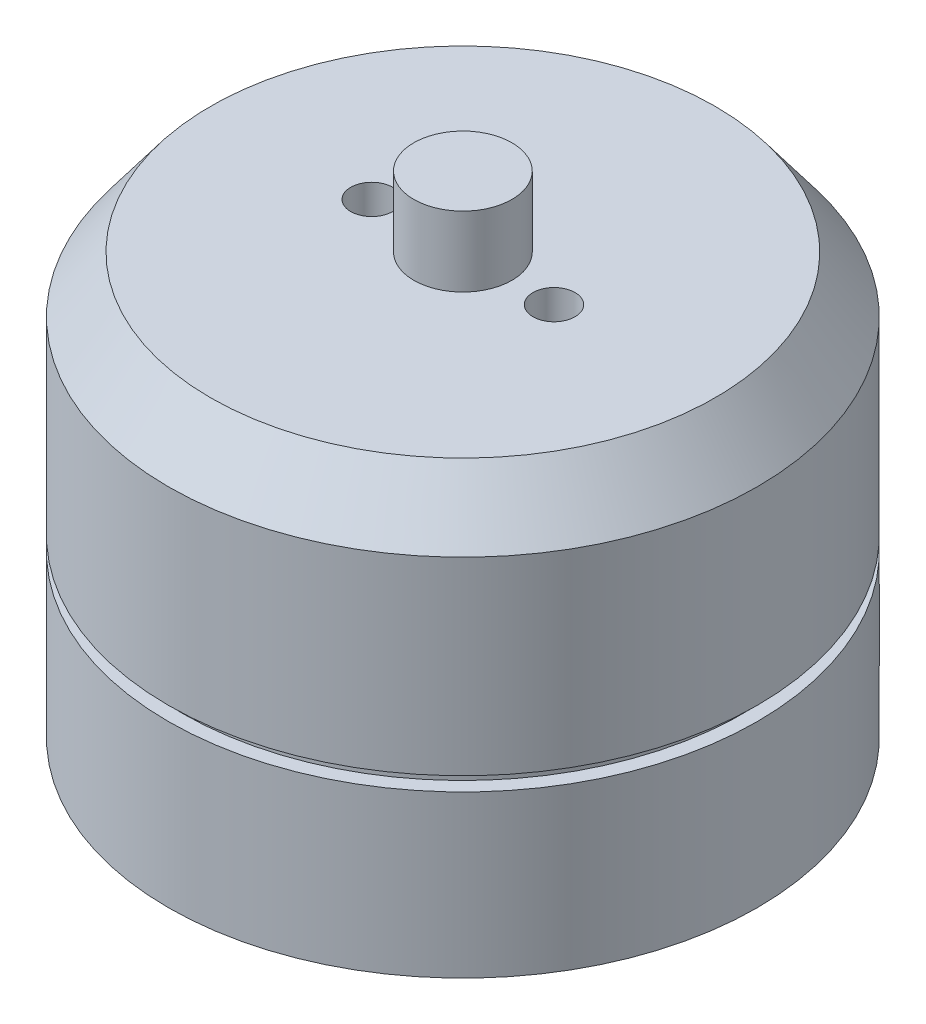
from build123d import *

# Parameters (mm, degrees)
SKETCH_1_R          = 21
EXTRUDE_1_DEPTH     = 30
CHAMFER_1_SIZE      = 4
CHAMFER_1_SIZE2     = 3
SKETCH_2_R          = 3.5
EXTRUDE_2_DEPTH     = 5
SKETCH_3_R          = 1.5
CUT_EXTRUDE_1_DEPTH = 4
SKETCH_4_R          = 13.365
EXTRUDE_3_DEPTH     = 2
SKETCH_5_R          = 1.5
CUT_EXTRUDE_2_DEPTH = 4
SKETCH_6_R          = 7.5
CUT_EXTRUDE_3_DEPTH = 5
SKETCH_7_R          = 2.5
EXTRUDE_4_DEPTH     = 12
SKETCH_8_W          = 1
SKETCH_8_H          = 1
EXTRUDE_5_DEPTH     = 7
SKETCH_10_W         = 30
SKETCH_10_H         = 4.75
CUT_EXTRUDE_4_DEPTH = 14


with BuildPart() as part:
    # 草图1 → 凸台-拉伸1 (new body)
    with BuildSketch(Plane(origin=(0, 0, 0), x_dir=(1, 0, 0), z_dir=(0, 1, 0))):
        with Locations(Location((0, 0, 0), (0, 0, 270))):
            Circle(SKETCH_1_R)
    extrude(amount=EXTRUDE_1_DEPTH)

    # 倒角1
    chamfer_1_edges = [part.edges().sort_by_distance(p)[0] for p in [
        (0, 30, -21),
    ]]
    chamfer_1_side = [part.faces().sort_by_distance(p)[0] for p in [
        (0, 15, -21),
    ]]
    chamfer(chamfer_1_edges, length=CHAMFER_1_SIZE, length2=CHAMFER_1_SIZE2, reference=chamfer_1_side[0])

    # 草图2 → 凸台-拉伸2 (add)
    with BuildSketch(Plane(origin=(0, 30, 0), x_dir=(1, 0, 0), z_dir=(0, 1, 0))):
        with Locations(Location((0, 0, 0), (0, 0, 270))):
            Circle(SKETCH_2_R)
    extrude(amount=EXTRUDE_2_DEPTH)

    # 草图3 → 切除-拉伸1 (cut)
    with BuildSketch(Plane(origin=(0, 30, 0), x_dir=(1, 0, 0), z_dir=(0, 1, 0))):
        with Locations(Location((6.5, 0, 0), (0, 0, 270))):
            Circle(SKETCH_3_R)
        with Locations(Location((-6.5, 0, 0), (0, 0, 270))):
            Circle(SKETCH_3_R)
    extrude(amount=-CUT_EXTRUDE_1_DEPTH, mode=Mode.SUBTRACT)

    # 草图4 → 凸台-拉伸3 (add)
    with BuildSketch(Plane(origin=(0, 0, 0), x_dir=(-1, 0, 0), z_dir=(0, -1, 0))):
        with Locations(Location((0, 0, 0), (0, 0, 270))):
            Circle(SKETCH_4_R)
    extrude(amount=EXTRUDE_3_DEPTH)

    # 草图5 → 切除-拉伸2 (cut)
    with BuildSketch(Plane(origin=(0, 0, 0), x_dir=(-1, 0, 0), z_dir=(0, -1, 0))):
        with Locations(Location((0, 17.5, 0), (0, 0, 90))):
            Circle(SKETCH_5_R)
        with Locations(Location((17.5, 0, 0), (0, 0, 90))):
            Circle(SKETCH_5_R)
        with Locations(Location((0, -17.5, 0), (0, 0, 90))):
            Circle(SKETCH_5_R)
        with Locations(Location((-17.5, 0, 0), (0, 0, 90))):
            Circle(SKETCH_5_R)
    extrude(amount=-CUT_EXTRUDE_2_DEPTH, mode=Mode.SUBTRACT)

    # 草图6 → 切除-拉伸3 (cut)
    with BuildSketch(Plane(origin=(0, -2, 0), x_dir=(-1, 0, 0), z_dir=(0, -1, 0))):
        with Locations(Location((0, 0, 0), (0, 0, 90))):
            Circle(SKETCH_6_R)
    extrude(amount=-CUT_EXTRUDE_3_DEPTH, mode=Mode.SUBTRACT)

    # 草图7 → 凸台-拉伸4 (add)
    with BuildSketch(Plane.XZ.offset(-3)):
        with Locations(Location((0, 0, 0), (0, 0, 270))):
            Circle(SKETCH_7_R)
    extrude(amount=EXTRUDE_4_DEPTH)

    # 草图8 → 切除-旋转1 (revolve, cut)
    with BuildSketch(Plane.XY, mode=Mode.PRIVATE) as cut_revolve_1_sk:
        with Locations((20.5, 12)):
            Rectangle(SKETCH_8_W, SKETCH_8_H)
    revolve(cut_revolve_1_sk.sketch.rotate(Axis((0, 26, 0), (0, -1, 0)), 90), axis=Axis((0, 26, 0), (0, -1, 0)), mode=Mode.SUBTRACT)

    # 草图9 → 凸台-拉伸5 (add)
    with BuildSketch(Plane.XZ.offset(9)):
        with BuildLine():
            ThreePointArc((3.27151241, -4.667676679), (3.435017376, -4.548698127), (3.594199256, -4.423994884))
            add(Edge.make_bspline(
                [(3.594199256, -4.423994884), (3.588341673, -4.371055443), (3.57704392, -4.288510414), (3.557045842, -4.17871332), (3.539100697, -4.095704087), (3.519699831, -4.018319233), (3.499191117, -3.946559726), (3.477920831, -3.880409738), (3.45623283, -3.819836866), (3.434467864, -3.76479225), (3.412962855, -3.71521076), (3.392050226, -3.671011182), (3.372057121, -3.632096507), (3.353305016, -3.598354002), (3.336108146, -3.569656099), (3.320775554, -3.545858911), (3.307602583, -3.526807808), (3.296891803, -3.512323476), (3.271755519, -3.480616202), (3.239242012, -3.449111408), (3.208005361, -3.408624212), (3.18990316, -3.383474283), (3.173472114, -3.358149214), (3.158636222, -3.332641108), (3.14542754, -3.306831197), (3.13388011, -3.280586394), (3.124075096, -3.253727871), (3.116155498, -3.226036506), (3.110360385, -3.197258888), (3.107065727, -3.167134913), (3.106830778, -3.135461921), (3.110417787, -3.102209244), (3.118774687, -3.067710564), (3.132765682, -3.032794727), (3.15151345, -3.001930189), (3.178982829, -2.967515274), (3.215428082, -2.931250004), (3.248175907, -2.891614083), (3.279909459, -2.861086475), (3.30891251, -2.839570861), (3.342388475, -2.822417923), (3.375968913, -2.810913535), (3.408748772, -2.804273658), (3.440308331, -2.801585189), (3.470607796, -2.802086304), (3.499797359, -2.805201432), (3.528101325, -2.810532209), (3.555749968, -2.817817205), (3.582948277, -2.826893811), (3.609866831, -2.837664709), (3.636635008, -2.850083723), (3.663368109, -2.864107974), (3.690081014, -2.879812412), (3.733277653, -2.907180126), (3.767648021, -2.93664804), (3.801539322, -2.958751519), (3.816950132, -2.968080162), (3.837135415, -2.979439126), (3.862245801, -2.992510584), (3.892408011, -3.006986188), (3.927736802, -3.022544934), (3.968330205, -3.038862158), (4.01427081, -3.055607355), (4.065625025, -3.072445825), (4.122443048, -3.089039069), (4.184758644, -3.105045593), (4.252589022, -3.120121593), (4.325934721, -3.133921689), (4.40477955, -3.14609962), (4.48909045, -3.156309089), (4.600264359, -3.16609106), (4.68349969, -3.169724325), (4.736753771, -3.170672285)],
                knots=[0.010676911, 0.010676911, 0.010676911, 0.010676911, 0.058364616, 0.085243058, 0.110585589, 0.134392209, 0.156662918, 0.177397716, 0.196596603, 0.21425958, 0.230386645, 0.2449778, 0.258033043, 0.269552376, 0.279535798, 0.287983309, 0.29489491, 0.3002706, 0.304110379, 0.331113618, 0.34062545, 0.349862158, 0.358855237, 0.367643072, 0.376272627, 0.384801461, 0.393300011, 0.401853859, 0.410565316, 0.419552882, 0.42894596, 0.438870848, 0.449423906, 0.460632045, 0.472412501, 0.481614351, 0.5, 0.518385649, 0.527587499, 0.539367955, 0.550576094, 0.561129152, 0.57105404, 0.580447118, 0.589434684, 0.598146141, 0.606699989, 0.615198539, 0.623727373, 0.632356928, 0.641144763, 0.650137842, 0.65937455, 0.668886382, 0.695889621, 0.6997294, 0.70510509, 0.712016691, 0.720464202, 0.730447624, 0.741966957, 0.7550222, 0.769613355, 0.78574042, 0.803403397, 0.822602284, 0.843337082, 0.865607791, 0.889414411, 0.914756942, 0.941635384, 0.989323089, 0.989323089, 0.989323089, 0.989323089], degree=3))
            ThreePointArc((4.736753771, -3.170672285), (4.846237601, -3.000663283), (4.949622276, -2.826877845))
            add(Edge.make_bspline(
                [(4.949622276, -2.826877845), (4.925036311, -2.779629288), (4.884682766, -2.706739561), (4.826371829, -2.611580959), (4.779652085, -2.540659688), (4.733606683, -2.475508863), (4.688560353, -2.416003717), (4.64483027, -2.362004404), (4.602725366, -2.313356492), (4.562545731, -2.269891329), (4.524582007, -2.231426472), (4.489114832, -2.197766106), (4.456414215, -2.168701595), (4.4267392, -2.144011687), (4.400336717, -2.123463916), (4.377442965, -2.10681247), (4.358277483, -2.093806472), (4.343057634, -2.084169414), (4.308164759, -2.063683534), (4.266465973, -2.046051422), (4.222713001, -2.019582216), (4.196747998, -2.002669875), (4.172278035, -1.98499053), (4.149229386, -1.966564272), (4.127589042, -1.947268774), (4.107340668, -1.926967636), (4.088495347, -1.905464789), (4.071107267, -1.882504249), (4.055307811, -1.857763355), (4.041353598, -1.830863753), (4.029692911, -1.80141444), (4.021025444, -1.769111466), (4.016355661, -1.733923544), (4.01678882, -1.696311366), (4.023121036, -1.660758566), (4.036303368, -1.618744529), (4.057187027, -1.571762628), (4.073405319, -1.522973354), (4.091968131, -1.483043726), (4.111240334, -1.452503903), (4.136259386, -1.424416351), (4.163416348, -1.401558176), (4.191584055, -1.383525224), (4.220041281, -1.369617674), (4.248475714, -1.35913952), (4.276819485, -1.351499804), (4.305137846, -1.346246034), (4.333551082, -1.343051249), (4.362191599, -1.341689769), (4.391183299, -1.342009228), (4.420630146, -1.343919833), (4.450624165, -1.347339948), (4.481206304, -1.352334086), (4.531372329, -1.362249293), (4.574066781, -1.377311296), (4.613654175, -1.385679226), (4.631394222, -1.388810901), (4.654319769, -1.392111054), (4.682456462, -1.395228908), (4.715811076, -1.397831159), (4.75437466, -1.399577026), (4.798121343, -1.400128356), (4.847008743, -1.399147126), (4.90097788, -1.39629725), (4.95995328, -1.391244952), (5.023843065, -1.383659602), (5.092539089, -1.373214394), (5.165917086, -1.359587077), (5.243836876, -1.342460623), (5.326142534, -1.321524058), (5.433342772, -1.290484828), (5.512269894, -1.263804677), (5.562270288, -1.24545103)],
                knots=[0.010676911, 0.010676911, 0.010676911, 0.010676911, 0.058364616, 0.085243058, 0.110585589, 0.134392209, 0.156662918, 0.177397716, 0.196596603, 0.21425958, 0.230386645, 0.2449778, 0.258033043, 0.269552376, 0.279535798, 0.287983309, 0.29489491, 0.3002706, 0.304110379, 0.331113618, 0.34062545, 0.349862158, 0.358855237, 0.367643072, 0.376272627, 0.384801461, 0.393300011, 0.401853859, 0.410565316, 0.419552882, 0.42894596, 0.438870848, 0.449423906, 0.460632045, 0.472412501, 0.481614351, 0.5, 0.518385649, 0.527587499, 0.539367955, 0.550576094, 0.561129152, 0.57105404, 0.580447118, 0.589434684, 0.598146141, 0.606699989, 0.615198539, 0.623727373, 0.632356928, 0.641144763, 0.650137842, 0.65937455, 0.668886382, 0.695889621, 0.6997294, 0.70510509, 0.712016691, 0.720464202, 0.730447624, 0.741966957, 0.7550222, 0.769613355, 0.78574042, 0.803403397, 0.822602284, 0.843337082, 0.865607791, 0.889414411, 0.914756942, 0.941635384, 0.989323089, 0.989323089, 0.989323089, 0.989323089], degree=3))
            ThreePointArc((5.562270288, -1.24545103), (5.602946584, -1.047372236), (5.636571381, -0.847975288))
            add(Edge.make_bspline(
                [(5.636571381, -0.847975288), (5.596577504, -0.812798797), (5.532618137, -0.759408532), (5.443869556, -0.691740119), (5.374684975, -0.64248512), (5.308213723, -0.598367303), (5.244713533, -0.559153018), (5.184429643, -0.524597286), (5.127594337, -0.494444505), (5.074426515, -0.468429006), (5.025131288, -0.446275674), (4.979899606, -0.427700539), (4.938907876, -0.412411514), (4.902317725, -0.400108714), (4.870275432, -0.390486164), (4.842912448, -0.383229331), (4.82034286, -0.378024969), (4.802669467, -0.374536724), (4.762732476, -0.36803897), (4.717480062, -0.366660855), (4.667119851, -0.357784451), (4.636798765, -0.351393804), (4.607594687, -0.343747876), (4.57944613, -0.334892034), (4.552296772, -0.324716912), (4.526082109, -0.313101221), (4.500741646, -0.299858128), (4.476233441, -0.284729362), (4.452563445, -0.267366587), (4.429834272, -0.247324298), (4.408322686, -0.224075958), (4.388571334, -0.197085382), (4.371505548, -0.165960542), (4.35832237, -0.130731755), (4.351383833, -0.095292296), (4.348498771, -0.051353366), (4.351000383, 0), (4.348498771, 0.051353366), (4.351383833, 0.095292296), (4.35832237, 0.130731755), (4.371505548, 0.165960542), (4.388571334, 0.197085382), (4.408322686, 0.224075958), (4.429834272, 0.247324298), (4.452563445, 0.267366587), (4.476233441, 0.284729362), (4.500741646, 0.299858128), (4.526082109, 0.313101221), (4.552296772, 0.324716912), (4.57944613, 0.334892034), (4.607594687, 0.343747876), (4.636798765, 0.351393804), (4.667119851, 0.357784451), (4.717480062, 0.366660855), (4.762732476, 0.36803897), (4.802669467, 0.374536724), (4.82034286, 0.378024969), (4.842912448, 0.383229331), (4.870275432, 0.390486164), (4.902317725, 0.400108714), (4.938907876, 0.412411514), (4.979899606, 0.427700539), (5.025131288, 0.446275674), (5.074426515, 0.468429006), (5.127594337, 0.494444505), (5.184429643, 0.524597286), (5.244713533, 0.559153018), (5.308213723, 0.598367303), (5.374684975, 0.64248512), (5.443869556, 0.691740119), (5.532618137, 0.759408532), (5.596577504, 0.812798797), (5.636571381, 0.847975288)],
                knots=[0.010676911, 0.010676911, 0.010676911, 0.010676911, 0.058364616, 0.085243058, 0.110585589, 0.134392209, 0.156662918, 0.177397716, 0.196596603, 0.21425958, 0.230386645, 0.2449778, 0.258033043, 0.269552376, 0.279535798, 0.287983309, 0.29489491, 0.3002706, 0.304110379, 0.331113618, 0.34062545, 0.349862158, 0.358855237, 0.367643072, 0.376272627, 0.384801461, 0.393300011, 0.401853859, 0.410565316, 0.419552882, 0.42894596, 0.438870848, 0.449423906, 0.460632045, 0.472412501, 0.481614351, 0.5, 0.518385649, 0.527587499, 0.539367955, 0.550576094, 0.561129152, 0.57105404, 0.580447118, 0.589434684, 0.598146141, 0.606699989, 0.615198539, 0.623727373, 0.632356928, 0.641144763, 0.650137842, 0.65937455, 0.668886382, 0.695889621, 0.6997294, 0.70510509, 0.712016691, 0.720464202, 0.730447624, 0.741966957, 0.7550222, 0.769613355, 0.78574042, 0.803403397, 0.822602284, 0.843337082, 0.865607791, 0.889414411, 0.914756942, 0.941635384, 0.989323089, 0.989323089, 0.989323089, 0.989323089], degree=3))
            ThreePointArc((5.636571381, 0.847975288), (5.602946584, 1.047372236), (5.562270288, 1.24545103))
            add(Edge.make_bspline(
                [(5.562270288, 1.24545103), (5.512269894, 1.263804677), (5.433342772, 1.290484828), (5.326142534, 1.321524058), (5.243836876, 1.342460623), (5.165917086, 1.359587077), (5.092539089, 1.373214394), (5.023843065, 1.383659602), (4.95995328, 1.391244952), (4.90097788, 1.39629725), (4.847008743, 1.399147126), (4.798121343, 1.400128356), (4.75437466, 1.399577026), (4.715811076, 1.397831159), (4.682456462, 1.395228908), (4.654319769, 1.392111054), (4.631394222, 1.388810901), (4.613654175, 1.385679226), (4.574066781, 1.377311296), (4.531372329, 1.362249293), (4.481206304, 1.352334086), (4.450624165, 1.347339948), (4.420630146, 1.343919833), (4.391183299, 1.342009228), (4.362191599, 1.341689769), (4.333551082, 1.343051249), (4.305137846, 1.346246034), (4.276819485, 1.351499804), (4.248475714, 1.35913952), (4.220041281, 1.369617674), (4.191584055, 1.383525224), (4.163416348, 1.401558176), (4.136259386, 1.424416351), (4.111240334, 1.452503903), (4.091968131, 1.483043726), (4.073405319, 1.522973354), (4.057187027, 1.571762628), (4.036303368, 1.618744529), (4.023121036, 1.660758566), (4.01678882, 1.696311366), (4.016355661, 1.733923544), (4.021025444, 1.769111466), (4.029692911, 1.80141444), (4.041353598, 1.830863753), (4.055307811, 1.857763355), (4.071107267, 1.882504249), (4.088495347, 1.905464789), (4.107340668, 1.926967636), (4.127589042, 1.947268774), (4.149229386, 1.966564272), (4.172278035, 1.98499053), (4.196747998, 2.002669875), (4.222713001, 2.019582216), (4.266465973, 2.046051422), (4.308164759, 2.063683534), (4.343057634, 2.084169414), (4.358277483, 2.093806472), (4.377442965, 2.10681247), (4.400336717, 2.123463916), (4.4267392, 2.144011687), (4.456414215, 2.168701595), (4.489114832, 2.197766106), (4.524582007, 2.231426472), (4.562545731, 2.269891329), (4.602725366, 2.313356492), (4.64483027, 2.362004404), (4.688560353, 2.416003717), (4.733606683, 2.475508863), (4.779652085, 2.540659688), (4.826371829, 2.611580959), (4.884682766, 2.706739561), (4.925036311, 2.779629288), (4.949622276, 2.826877845)],
                knots=[0.010676911, 0.010676911, 0.010676911, 0.010676911, 0.058364616, 0.085243058, 0.110585589, 0.134392209, 0.156662918, 0.177397716, 0.196596603, 0.21425958, 0.230386645, 0.2449778, 0.258033043, 0.269552376, 0.279535798, 0.287983309, 0.29489491, 0.3002706, 0.304110379, 0.331113618, 0.34062545, 0.349862158, 0.358855237, 0.367643072, 0.376272627, 0.384801461, 0.393300011, 0.401853859, 0.410565316, 0.419552882, 0.42894596, 0.438870848, 0.449423906, 0.460632045, 0.472412501, 0.481614351, 0.5, 0.518385649, 0.527587499, 0.539367955, 0.550576094, 0.561129152, 0.57105404, 0.580447118, 0.589434684, 0.598146141, 0.606699989, 0.615198539, 0.623727373, 0.632356928, 0.641144763, 0.650137842, 0.65937455, 0.668886382, 0.695889621, 0.6997294, 0.70510509, 0.712016691, 0.720464202, 0.730447624, 0.741966957, 0.7550222, 0.769613355, 0.78574042, 0.803403397, 0.822602284, 0.843337082, 0.865607791, 0.889414411, 0.914756942, 0.941635384, 0.989323089, 0.989323089, 0.989323089, 0.989323089], degree=3))
            ThreePointArc((4.949622276, 2.826877845), (4.846237601, 3.000663283), (4.736753771, 3.170672285))
            add(Edge.make_bspline(
                [(4.736753771, 3.170672285), (4.68349969, 3.169724325), (4.600264359, 3.16609106), (4.48909045, 3.156309089), (4.40477955, 3.14609962), (4.325934721, 3.133921689), (4.252589022, 3.120121593), (4.184758644, 3.105045593), (4.122443048, 3.089039069), (4.065625025, 3.072445825), (4.01427081, 3.055607355), (3.968330205, 3.038862158), (3.927736802, 3.022544934), (3.892408011, 3.006986188), (3.862245801, 2.992510584), (3.837135415, 2.979439126), (3.816950132, 2.968080162), (3.801539322, 2.958751519), (3.767648021, 2.93664804), (3.733277653, 2.907180126), (3.690081014, 2.879812412), (3.663368109, 2.864107974), (3.636635008, 2.850083723), (3.609866831, 2.837664709), (3.582948277, 2.826893811), (3.555749968, 2.817817205), (3.528101325, 2.810532209), (3.499797359, 2.805201432), (3.470607796, 2.802086304), (3.440308331, 2.801585189), (3.408748772, 2.804273658), (3.375968913, 2.810913535), (3.342388475, 2.822417923), (3.30891251, 2.839570861), (3.279909459, 2.861086475), (3.248175907, 2.891614083), (3.215428082, 2.931250004), (3.178982829, 2.967515274), (3.15151345, 3.001930189), (3.132765682, 3.032794727), (3.118774687, 3.067710564), (3.110417787, 3.102209244), (3.106830778, 3.135461921), (3.107065727, 3.167134913), (3.110360385, 3.197258888), (3.116155498, 3.226036506), (3.124075096, 3.253727871), (3.13388011, 3.280586394), (3.14542754, 3.306831197), (3.158636222, 3.332641108), (3.173472114, 3.358149214), (3.18990316, 3.383474283), (3.208005361, 3.408624212), (3.239242012, 3.449111408), (3.271755519, 3.480616202), (3.296891803, 3.512323476), (3.307602583, 3.526807808), (3.320775554, 3.545858911), (3.336108146, 3.569656099), (3.353305016, 3.598354002), (3.372057121, 3.632096507), (3.392050226, 3.671011182), (3.412962855, 3.71521076), (3.434467864, 3.76479225), (3.45623283, 3.819836866), (3.477920831, 3.880409738), (3.499191117, 3.946559726), (3.519699831, 4.018319233), (3.539100697, 4.095704087), (3.557045842, 4.17871332), (3.57704392, 4.288510414), (3.588341673, 4.371055443), (3.594199256, 4.423994884)],
                knots=[0.010676911, 0.010676911, 0.010676911, 0.010676911, 0.058364616, 0.085243058, 0.110585589, 0.134392209, 0.156662918, 0.177397716, 0.196596603, 0.21425958, 0.230386645, 0.2449778, 0.258033043, 0.269552376, 0.279535798, 0.287983309, 0.29489491, 0.3002706, 0.304110379, 0.331113618, 0.34062545, 0.349862158, 0.358855237, 0.367643072, 0.376272627, 0.384801461, 0.393300011, 0.401853859, 0.410565316, 0.419552882, 0.42894596, 0.438870848, 0.449423906, 0.460632045, 0.472412501, 0.481614351, 0.5, 0.518385649, 0.527587499, 0.539367955, 0.550576094, 0.561129152, 0.57105404, 0.580447118, 0.589434684, 0.598146141, 0.606699989, 0.615198539, 0.623727373, 0.632356928, 0.641144763, 0.650137842, 0.65937455, 0.668886382, 0.695889621, 0.6997294, 0.70510509, 0.712016691, 0.720464202, 0.730447624, 0.741966957, 0.7550222, 0.769613355, 0.78574042, 0.803403397, 0.822602284, 0.843337082, 0.865607791, 0.889414411, 0.914756942, 0.941635384, 0.989323089, 0.989323089, 0.989323089, 0.989323089], degree=3))
            ThreePointArc((3.594199256, 4.423994884), (3.435017376, 4.548698127), (3.27151241, 4.667676679))
            add(Edge.make_bspline(
                [(3.27151241, 4.667676679), (3.222196901, 4.64755514), (3.145894752, 4.614099151), (3.045761826, 4.564817086), (2.970832338, 4.524840431), (2.901710901, 4.48500281), (2.838303243, 4.445639081), (2.780499378, 4.407077972), (2.72817404, 4.369641343), (2.681186982, 4.333643566), (2.639383359, 4.299390878), (2.602594084, 4.267180787), (2.570636325, 4.237301399), (2.543313675, 4.21003107), (2.520417443, 4.185637125), (2.501724661, 4.164377435), (2.487005776, 4.146493752), (2.476005518, 4.132228024), (2.452387519, 4.099374194), (2.430983144, 4.059480173), (2.400589836, 4.018356114), (2.381353891, 3.994062347), (2.36149216, 3.971328012), (2.341017844, 3.950077846), (2.319807938, 3.93031018), (2.297725117, 3.912021334), (2.27457517, 3.895240436), (2.250108207, 3.880045062), (2.224015063, 3.866595806), (2.195942678, 3.855183101), (2.165543078, 3.846289396), (2.13257817, 3.840639446), (2.09710948, 3.839236315), (2.059697716, 3.84313804), (2.02488084, 3.852723642), (1.98426234, 3.869726307), (1.939407757, 3.894855824), (1.892323044, 3.915506637), (1.854276509, 3.937674505), (1.825645179, 3.959682355), (1.79998591, 3.987186273), (1.779730972, 4.016336474), (1.764373934, 4.046047894), (1.753151412, 4.075666953), (1.745341555, 4.104946892), (1.740349661, 4.133874657), (1.737731192, 4.162556974), (1.737171678, 4.191143781), (1.738458619, 4.219787744), (1.741451733, 4.248626295), (1.7460712, 4.277771239), (1.752244224, 4.30732174), (1.760038821, 4.33731262), (1.774540469, 4.386349786), (1.793477567, 4.427472364), (1.805462465, 4.466118791), (1.810217625, 4.483494208), (1.815619003, 4.506017458), (1.821319683, 4.533746446), (1.826988409, 4.56671867), (1.832285027, 4.60495666), (1.83687044, 4.648465856), (1.840404156, 4.697235249), (1.842546081, 4.751237116), (1.842956898, 4.810427104), (1.841298912, 4.874744235), (1.837236731, 4.944110975), (1.830438013, 5.018433325), (1.820574148, 5.097600953), (1.807321104, 5.181487293), (1.786305471, 5.291094172), (1.767021609, 5.372146338), (1.75335971, 5.4236269)],
                knots=[0.010676911, 0.010676911, 0.010676911, 0.010676911, 0.058364616, 0.085243058, 0.110585589, 0.134392209, 0.156662918, 0.177397716, 0.196596603, 0.21425958, 0.230386645, 0.2449778, 0.258033043, 0.269552376, 0.279535798, 0.287983309, 0.29489491, 0.3002706, 0.304110379, 0.331113618, 0.34062545, 0.349862158, 0.358855237, 0.367643072, 0.376272627, 0.384801461, 0.393300011, 0.401853859, 0.410565316, 0.419552882, 0.42894596, 0.438870848, 0.449423906, 0.460632045, 0.472412501, 0.481614351, 0.5, 0.518385649, 0.527587499, 0.539367955, 0.550576094, 0.561129152, 0.57105404, 0.580447118, 0.589434684, 0.598146141, 0.606699989, 0.615198539, 0.623727373, 0.632356928, 0.641144763, 0.650137842, 0.65937455, 0.668886382, 0.695889621, 0.6997294, 0.70510509, 0.712016691, 0.720464202, 0.730447624, 0.741966957, 0.7550222, 0.769613355, 0.78574042, 0.803403397, 0.822602284, 0.843337082, 0.865607791, 0.889414411, 0.914756942, 0.941635384, 0.989323089, 0.989323089, 0.989323089, 0.989323089], degree=3))
            ThreePointArc((1.75335971, 5.4236269), (1.55987902, 5.482406084), (1.36443517, 5.534285473))
            add(Edge.make_bspline(
                [(1.36443517, 5.534285473), (1.325718565, 5.49770788), (1.266654628, 5.438947584), (1.19108619, 5.356821242), (1.135657757, 5.292476468), (1.085594945, 5.23035945), (1.040688884, 5.170748378), (1.000718265, 5.11391005), (0.96545001, 5.06009934), (0.93463978, 5.009558731), (0.908032561, 4.96251784), (0.885363211, 4.919193005), (0.866357167, 4.879786832), (0.850730734, 4.844487927), (0.838192743, 4.813470178), (0.828442129, 4.786893496), (0.821177509, 4.764900383), (0.816073449, 4.747624236), (0.805918493, 4.708457147), (0.80037089, 4.663524928), (0.786885698, 4.614198556), (0.777724635, 4.584596469), (0.767416711, 4.556222448), (0.756001426, 4.529011082), (0.743364681, 4.50291638), (0.729379758, 4.477885305), (0.713855034, 4.453874858), (0.696529473, 4.430867107), (0.677056773, 4.408900118), (0.655002797, 4.388117173), (0.629868792, 4.368842438), (0.601170928, 4.351665718), (0.568604229, 4.337544569), (0.532309332, 4.327668131), (0.496380844, 4.324029133), (0.452363149, 4.325210551), (0.401459667, 4.332439782), (0.350094546, 4.334687133), (0.306609252, 4.34161406), (0.271961178, 4.35179294), (0.238099062, 4.368170382), (0.208681627, 4.388035207), (0.183628613, 4.41019268), (0.162464285, 4.433757587), (0.144604676, 4.458239071), (0.12949996, 4.483410129), (0.116697062, 4.509209693), (0.105848584, 4.535663977), (0.096701229, 4.562838574), (0.089074538, 4.590810959), (0.082853694, 4.619656553), (0.077934996, 4.649441529), (0.074369286, 4.680222925), (0.070177402, 4.731187319), (0.072980531, 4.776373851), (0.070195416, 4.816740014), (0.068352747, 4.834659871), (0.065253045, 4.857613379), (0.060551905, 4.885529213), (0.053926894, 4.918322676), (0.045052688, 4.955891899), (0.033611123, 4.998119459), (0.019288679, 5.044872088), (0.001778239, 5.096001082), (-0.019220575, 5.151342507), (-0.044000629, 5.210717511), (-0.072846657, 5.273932641), (-0.106034601, 5.340780189), (-0.143831027, 5.411038564), (-0.186492364, 5.484472694), (-0.24568343, 5.579086343), (-0.292944515, 5.647699103), (-0.324280781, 5.69076805)],
                knots=[0.010676911, 0.010676911, 0.010676911, 0.010676911, 0.058364616, 0.085243058, 0.110585589, 0.134392209, 0.156662918, 0.177397716, 0.196596603, 0.21425958, 0.230386645, 0.2449778, 0.258033043, 0.269552376, 0.279535798, 0.287983309, 0.29489491, 0.3002706, 0.304110379, 0.331113618, 0.34062545, 0.349862158, 0.358855237, 0.367643072, 0.376272627, 0.384801461, 0.393300011, 0.401853859, 0.410565316, 0.419552882, 0.42894596, 0.438870848, 0.449423906, 0.460632045, 0.472412501, 0.481614351, 0.5, 0.518385649, 0.527587499, 0.539367955, 0.550576094, 0.561129152, 0.57105404, 0.580447118, 0.589434684, 0.598146141, 0.606699989, 0.615198539, 0.623727373, 0.632356928, 0.641144763, 0.650137842, 0.65937455, 0.668886382, 0.695889621, 0.6997294, 0.70510509, 0.712016691, 0.720464202, 0.730447624, 0.741966957, 0.7550222, 0.769613355, 0.78574042, 0.803403397, 0.822602284, 0.843337082, 0.865607791, 0.889414411, 0.914756942, 0.941635384, 0.989323089, 0.989323089, 0.989323089, 0.989323089], degree=3))
            ThreePointArc((-0.324280781, 5.69076805), (-0.525929641, 5.67568472), (-0.726916601, 5.653458347))
            add(Edge.make_bspline(
                [(-0.726916601, 5.653458347), (-0.749805409, 5.605364707), (-0.783654223, 5.529236008), (-0.824452236, 5.425357006), (-0.852893697, 5.345334232), (-0.877136624, 5.269327064), (-0.897476276, 5.197519454), (-0.914215396, 5.130080238), (-0.927663394, 5.067162883), (-0.938135703, 5.008905229), (-0.945953066, 4.955429269), (-0.951440871, 4.906840949), (-0.954928327, 4.863230012), (-0.956748106, 4.824669846), (-0.957234531, 4.791217411), (-0.956726104, 4.762913065), (-0.955555331, 4.739780815), (-0.954073861, 4.721827488), (-0.949394291, 4.681636872), (-0.938335887, 4.637734801), (-0.933091713, 4.586867915), (-0.930940643, 4.555955433), (-0.930302617, 4.525773795), (-0.931117175, 4.496276275), (-0.933474094, 4.467378772), (-0.93747238, 4.438986052), (-0.943275179, 4.4109888), (-0.951119426, 4.383275997), (-0.961341786, 4.355758039), (-0.97439884, 4.328411705), (-0.990872765, 4.3013591), (-1.011427779, 4.274975421), (-1.036694174, 4.250043393), (-1.066970377, 4.22772266), (-1.099158136, 4.211350528), (-1.140630192, 4.196551143), (-1.190707775, 4.184903742), (-1.23941616, 4.168444112), (-1.282467285, 4.159194579), (-1.318452686, 4.156169774), (-1.355944384, 4.159208877), (-1.390551327, 4.167105471), (-1.42191677, 4.178716506), (-1.450164545, 4.193044691), (-1.475661866, 4.20942136), (-1.498839429, 4.22743622), (-1.520097654, 4.246868656), (-1.539769947, 4.267617619), (-1.558116199, 4.28965277), (-1.575332667, 4.312981164), (-1.591553661, 4.337631652), (-1.606899785, 4.363628475), (-1.621344233, 4.39104319), (-1.643663512, 4.437051789), (-1.657372929, 4.480199582), (-1.674551912, 4.516833809), (-1.682743549, 4.532877928), (-1.693925699, 4.553161696), (-1.708393743, 4.577494188), (-1.726417748, 4.605679952), (-1.748264267, 4.637506476), (-1.774187562, 4.672749333), (-1.804431841, 4.711170998), (-1.839229763, 4.752521864), (-1.878802203, 4.79654056), (-1.92335764, 4.842954514), (-1.973091699, 4.89148048), (-2.028186655, 4.941825093), (-2.088811025, 4.993685433), (-2.155119005, 5.046749668), (-2.244491422, 5.113591989), (-2.313346859, 5.160498809), (-2.358125355, 5.189339441)],
                knots=[0.010676911, 0.010676911, 0.010676911, 0.010676911, 0.058364616, 0.085243058, 0.110585589, 0.134392209, 0.156662918, 0.177397716, 0.196596603, 0.21425958, 0.230386645, 0.2449778, 0.258033043, 0.269552376, 0.279535798, 0.287983309, 0.29489491, 0.3002706, 0.304110379, 0.331113618, 0.34062545, 0.349862158, 0.358855237, 0.367643072, 0.376272627, 0.384801461, 0.393300011, 0.401853859, 0.410565316, 0.419552882, 0.42894596, 0.438870848, 0.449423906, 0.460632045, 0.472412501, 0.481614351, 0.5, 0.518385649, 0.527587499, 0.539367955, 0.550576094, 0.561129152, 0.57105404, 0.580447118, 0.589434684, 0.598146141, 0.606699989, 0.615198539, 0.623727373, 0.632356928, 0.641144763, 0.650137842, 0.65937455, 0.668886382, 0.695889621, 0.6997294, 0.70510509, 0.712016691, 0.720464202, 0.730447624, 0.741966957, 0.7550222, 0.769613355, 0.78574042, 0.803403397, 0.822602284, 0.843337082, 0.865607791, 0.889414411, 0.914756942, 0.941635384, 0.989323089, 0.989323089, 0.989323089, 0.989323089], degree=3))
            ThreePointArc((-2.358125355, 5.189339441), (-2.54070859, 5.102430684), (-2.720094256, 5.009100344))
            add(Edge.make_bspline(
                [(-2.720094256, 5.009100344), (-2.724064007, 4.955985969), (-2.728126229, 4.87277047), (-2.728643819, 4.761168244), (-2.726257131, 4.676274988), (-2.721406031, 4.596642859), (-2.714432292, 4.522336727), (-2.705679201, 4.453404664), (-2.695490716, 4.389878), (-2.684210761, 4.331771321), (-2.67218249, 4.279082516), (-2.65974759, 4.231792834), (-2.647245459, 4.189867032), (-2.635012813, 4.153253367), (-2.623381978, 4.121884184), (-2.612683174, 4.095674832), (-2.603235129, 4.074527583), (-2.59536821, 4.058321774), (-2.576486115, 4.022535596), (-2.550315203, 3.98559289), (-2.527049918, 3.940055346), (-2.513877229, 3.912007371), (-2.502379422, 3.884094313), (-2.492483241, 3.856294443), (-2.484242021, 3.828496906), (-2.477713678, 3.800577136), (-2.473010853, 3.772374263), (-2.470314376, 3.743699175), (-2.46990581, 3.714346701), (-2.472202515, 3.684130252), (-2.477791464, 3.65295338), (-2.48742756, 3.620926005), (-2.501981285, 3.588550307), (-2.522149824, 3.556799817), (-2.54624972, 3.529905699), (-2.579575105, 3.501124249), (-2.622063534, 3.472173262), (-2.661536846, 3.439229615), (-2.698339508, 3.415052823), (-2.73080221, 3.39923285), (-2.766860027, 3.388523165), (-2.80198262, 3.38338505), (-2.835424414, 3.382881513), (-2.866940617, 3.386037875), (-2.896632095, 3.392097969), (-2.924752248, 3.400523624), (-2.951594757, 3.410964475), (-2.977434015, 3.423205855), (-3.0025014, 3.43712559), (-3.026982466, 3.452659364), (-3.051012876, 3.46978556), (-3.074713846, 3.488483217), (-3.09808623, 3.50882874), (-3.13551856, 3.543667828), (-3.163888992, 3.578949534), (-3.193141726, 3.606904169), (-3.206576004, 3.618905704), (-3.22433039, 3.633780295), (-3.24661135, 3.651243209), (-3.273600106, 3.671014629), (-3.305468445, 3.692800106), (-3.342372386, 3.716298517), (-3.384453843, 3.741200159), (-3.431839594, 3.767188234), (-3.484641182, 3.793939231), (-3.542954545, 3.821123674), (-3.606859774, 3.848406776), (-3.676420863, 3.875449135), (-3.75168552, 3.901907414), (-3.832684882, 3.927435134), (-3.94016841, 3.957478701), (-4.021318891, 3.976344555), (-4.073492033, 3.987061785)],
                knots=[0.010676911, 0.010676911, 0.010676911, 0.010676911, 0.058364616, 0.085243058, 0.110585589, 0.134392209, 0.156662918, 0.177397716, 0.196596603, 0.21425958, 0.230386645, 0.2449778, 0.258033043, 0.269552376, 0.279535798, 0.287983309, 0.29489491, 0.3002706, 0.304110379, 0.331113618, 0.34062545, 0.349862158, 0.358855237, 0.367643072, 0.376272627, 0.384801461, 0.393300011, 0.401853859, 0.410565316, 0.419552882, 0.42894596, 0.438870848, 0.449423906, 0.460632045, 0.472412501, 0.481614351, 0.5, 0.518385649, 0.527587499, 0.539367955, 0.550576094, 0.561129152, 0.57105404, 0.580447118, 0.589434684, 0.598146141, 0.606699989, 0.615198539, 0.623727373, 0.632356928, 0.641144763, 0.650137842, 0.65937455, 0.668886382, 0.695889621, 0.6997294, 0.70510509, 0.712016691, 0.720464202, 0.730447624, 0.741966957, 0.7550222, 0.769613355, 0.78574042, 0.803403397, 0.822602284, 0.843337082, 0.865607791, 0.889414411, 0.914756942, 0.941635384, 0.989323089, 0.989323089, 0.989323089, 0.989323089], degree=3))
            ThreePointArc((-4.073492033, 3.987061785), (-4.212350765, 3.840065111), (-4.34590811, 3.688235584))
            add(Edge.make_bspline(
                [(-4.34590811, 3.688235584), (-4.330422667, 3.637273865), (-4.30414967, 3.558210279), (-4.264316934, 3.453957327), (-4.231424433, 3.375658895), (-4.198134474, 3.303156566), (-4.164789185, 3.236387367), (-4.131726038, 3.175272113), (-4.09927708, 3.119715768), (-4.067768283, 3.069607693), (-4.037518862, 3.024821958), (-4.008840659, 2.985217647), (-3.982037422, 2.950639292), (-3.957404439, 2.920917007), (-3.935227152, 2.895867657), (-3.915782905, 2.875293018), (-3.899333597, 2.858986824), (-3.8861437, 2.846717216), (-3.855609213, 2.820168598), (-3.817860319, 2.795174574), (-3.779716029, 2.761116469), (-3.757300765, 2.739721036), (-3.73649602, 2.717846372), (-3.717225634, 2.695498677), (-3.699499297, 2.672555318), (-3.683326014, 2.648879218), (-3.668752708, 2.624279678), (-3.655879681, 2.598515034), (-3.644895368, 2.571292259), (-3.636121541, 2.542286594), (-3.630070696, 2.511196066), (-3.627486466, 2.477850468), (-3.629361959, 2.442403617), (-3.636698961, 2.40551145), (-3.649456169, 2.371727546), (-3.670134106, 2.332851125), (-3.699295083, 2.290506542), (-3.724202233, 2.245528102), (-3.749786028, 2.209689259), (-3.774341763, 2.183210693), (-3.804095892, 2.160198624), (-3.834990633, 2.142719731), (-3.865992279, 2.130169627), (-3.896520472, 2.121727881), (-3.92639611, 2.116652951), (-3.955661069, 2.114351469), (-3.984462634, 2.11439064), (-4.01297912, 2.116471171), (-4.041382149, 2.120395554), (-4.06982151, 2.126036785), (-4.098415896, 2.133325702), (-4.127270765, 2.142198969), (-4.156414514, 2.152727526), (-4.203904453, 2.171691891), (-4.243104315, 2.19434252), (-4.280480055, 2.209842134), (-4.297342601, 2.216180211), (-4.319271396, 2.223636731), (-4.346356104, 2.231871601), (-4.37866463, 2.240558438), (-4.416250793, 2.249360619), (-4.459151299, 2.257940993), (-4.507386599, 2.265959507), (-4.560960472, 2.273074958), (-4.619860061, 2.278945386), (-4.684055806, 2.283228908), (-4.753501451, 2.285584411), (-4.828134061, 2.285672297), (-4.907874096, 2.283155177), (-4.992625428, 2.277698723), (-5.103703822, 2.266885986), (-5.186189524, 2.255162936), (-5.23871104, 2.246309343)],
                knots=[0.010676911, 0.010676911, 0.010676911, 0.010676911, 0.058364616, 0.085243058, 0.110585589, 0.134392209, 0.156662918, 0.177397716, 0.196596603, 0.21425958, 0.230386645, 0.2449778, 0.258033043, 0.269552376, 0.279535798, 0.287983309, 0.29489491, 0.3002706, 0.304110379, 0.331113618, 0.34062545, 0.349862158, 0.358855237, 0.367643072, 0.376272627, 0.384801461, 0.393300011, 0.401853859, 0.410565316, 0.419552882, 0.42894596, 0.438870848, 0.449423906, 0.460632045, 0.472412501, 0.481614351, 0.5, 0.518385649, 0.527587499, 0.539367955, 0.550576094, 0.561129152, 0.57105404, 0.580447118, 0.589434684, 0.598146141, 0.606699989, 0.615198539, 0.623727373, 0.632356928, 0.641144763, 0.650137842, 0.65937455, 0.668886382, 0.695889621, 0.6997294, 0.70510509, 0.712016691, 0.720464202, 0.730447624, 0.741966957, 0.7550222, 0.769613355, 0.78574042, 0.803403397, 0.822602284, 0.843337082, 0.865607791, 0.889414411, 0.914756942, 0.941635384, 0.989323089, 0.989323089, 0.989323089, 0.989323089], degree=3))
            ThreePointArc((-5.23871104, 2.246309343), (-5.315091628, 2.059077466), (-5.384782992, 1.869254171))
            add(Edge.make_bspline(
                [(-5.384782992, 1.869254171), (-5.35193375, 1.82732777), (-5.298873848, 1.763094073), (-5.224070419, 1.680270334), (-5.165114418, 1.619141363), (-5.107881594, 1.563560674), (-5.052668221, 1.513345958), (-4.999760378, 1.468301468), (-4.94943336, 1.428218635), (-4.901951157, 1.392876537), (-4.857565939, 1.362042434), (-4.816517584, 1.335472276), (-4.779033167, 1.312911365), (-4.745326666, 1.294094621), (-4.715598093, 1.278748157), (-4.690034456, 1.26658695), (-4.668805457, 1.257324052), (-4.65207395, 1.250647723), (-4.614010922, 1.236922203), (-4.569782244, 1.227252444), (-4.521910546, 1.209273513), (-4.493280012, 1.197420194), (-4.465978125, 1.184538218), (-4.439936108, 1.170660879), (-4.415118693, 1.155670326), (-4.391484762, 1.139435483), (-4.36900918, 1.121761581), (-4.347698177, 1.10238704), (-4.32762161, 1.080970549), (-4.308962205, 1.057093044), (-4.292088766, 1.030287807), (-4.277633224, 1.000127495), (-4.266577189, 0.966396785), (-4.260091753, 0.929345433), (-4.25978334, 0.893234445), (-4.26502116, 0.84951353), (-4.276916333, 0.799494222), (-4.283893472, 0.748555575), (-4.294803167, 0.705894917), (-4.308135547, 0.672333835), (-4.327567528, 0.640127288), (-4.350061911, 0.612668238), (-4.374436464, 0.589766529), (-4.399853646, 0.570866779), (-4.425878573, 0.555342223), (-4.452335943, 0.542624433), (-4.479206753, 0.532256633), (-4.506549159, 0.523895327), (-4.534451845, 0.517294348), (-4.563008607, 0.512281157), (-4.592305138, 0.508748387), (-4.622416896, 0.506598881), (-4.653395987, 0.505888531), (-4.704529755, 0.50641693), (-4.749264888, 0.513377389), (-4.789715835, 0.514328674), (-4.807729268, 0.514147301), (-4.830870865, 0.513178704), (-4.859101382, 0.511073367), (-4.892366233, 0.507502416), (-4.930594001, 0.502132516), (-4.973697119, 0.494636027), (-5.021571819, 0.484688468), (-5.074098365, 0.471970314), (-5.131141239, 0.456167339), (-5.192549375, 0.436971427), (-5.258156416, 0.414081207), (-5.327781001, 0.38720275), (-5.40122708, 0.356050182), (-5.478284245, 0.320346478), (-5.577955751, 0.270137757), (-5.650636524, 0.229409065), (-5.696413092, 0.202180376)],
                knots=[0.010676911, 0.010676911, 0.010676911, 0.010676911, 0.058364616, 0.085243058, 0.110585589, 0.134392209, 0.156662918, 0.177397716, 0.196596603, 0.21425958, 0.230386645, 0.2449778, 0.258033043, 0.269552376, 0.279535798, 0.287983309, 0.29489491, 0.3002706, 0.304110379, 0.331113618, 0.34062545, 0.349862158, 0.358855237, 0.367643072, 0.376272627, 0.384801461, 0.393300011, 0.401853859, 0.410565316, 0.419552882, 0.42894596, 0.438870848, 0.449423906, 0.460632045, 0.472412501, 0.481614351, 0.5, 0.518385649, 0.527587499, 0.539367955, 0.550576094, 0.561129152, 0.57105404, 0.580447118, 0.589434684, 0.598146141, 0.606699989, 0.615198539, 0.623727373, 0.632356928, 0.641144763, 0.650137842, 0.65937455, 0.668886382, 0.695889621, 0.6997294, 0.70510509, 0.712016691, 0.720464202, 0.730447624, 0.741966957, 0.7550222, 0.769613355, 0.78574042, 0.803403397, 0.822602284, 0.843337082, 0.865607791, 0.889414411, 0.914756942, 0.941635384, 0.989323089, 0.989323089, 0.989323089, 0.989323089], degree=3))
            ThreePointArc((-5.696413092, 0.202180376), (-5.699999914, 0), (-5.696413092, -0.202180376))
            add(Edge.make_bspline(
                [(-5.696413092, -0.202180376), (-5.650636524, -0.229409065), (-5.577955751, -0.270137757), (-5.478284245, -0.320346478), (-5.40122708, -0.356050182), (-5.327781001, -0.38720275), (-5.258156416, -0.414081207), (-5.192549375, -0.436971427), (-5.131141239, -0.456167339), (-5.074098365, -0.471970314), (-5.021571819, -0.484688468), (-4.973697119, -0.494636027), (-4.930594001, -0.502132516), (-4.892366233, -0.507502416), (-4.859101382, -0.511073367), (-4.830870865, -0.513178704), (-4.807729268, -0.514147301), (-4.789715835, -0.514328674), (-4.749264888, -0.513377389), (-4.704529755, -0.50641693), (-4.653395987, -0.505888531), (-4.622416896, -0.506598881), (-4.592305138, -0.508748387), (-4.563008607, -0.512281157), (-4.534451845, -0.517294348), (-4.506549159, -0.523895327), (-4.479206753, -0.532256633), (-4.452335943, -0.542624433), (-4.425878573, -0.555342223), (-4.399853646, -0.570866779), (-4.374436464, -0.589766529), (-4.350061911, -0.612668238), (-4.327567528, -0.640127288), (-4.308135547, -0.672333835), (-4.294803167, -0.705894917), (-4.283893472, -0.748555575), (-4.276916333, -0.799494222), (-4.26502116, -0.84951353), (-4.25978334, -0.893234445), (-4.260091753, -0.929345433), (-4.266577189, -0.966396785), (-4.277633224, -1.000127495), (-4.292088766, -1.030287807), (-4.308962205, -1.057093044), (-4.32762161, -1.080970549), (-4.347698177, -1.10238704), (-4.36900918, -1.121761581), (-4.391484762, -1.139435483), (-4.415118693, -1.155670326), (-4.439936108, -1.170660879), (-4.465978125, -1.184538218), (-4.493280012, -1.197420194), (-4.521910546, -1.209273513), (-4.569782244, -1.227252444), (-4.614010922, -1.236922203), (-4.65207395, -1.250647723), (-4.668805457, -1.257324052), (-4.690034456, -1.26658695), (-4.715598093, -1.278748157), (-4.745326666, -1.294094621), (-4.779033167, -1.312911365), (-4.816517584, -1.335472276), (-4.857565939, -1.362042434), (-4.901951157, -1.392876537), (-4.94943336, -1.428218635), (-4.999760378, -1.468301468), (-5.052668221, -1.513345958), (-5.107881594, -1.563560674), (-5.165114418, -1.619141363), (-5.224070419, -1.680270334), (-5.298873848, -1.763094073), (-5.35193375, -1.82732777), (-5.384782992, -1.869254171)],
                knots=[0.010676911, 0.010676911, 0.010676911, 0.010676911, 0.058364616, 0.085243058, 0.110585589, 0.134392209, 0.156662918, 0.177397716, 0.196596603, 0.21425958, 0.230386645, 0.2449778, 0.258033043, 0.269552376, 0.279535798, 0.287983309, 0.29489491, 0.3002706, 0.304110379, 0.331113618, 0.34062545, 0.349862158, 0.358855237, 0.367643072, 0.376272627, 0.384801461, 0.393300011, 0.401853859, 0.410565316, 0.419552882, 0.42894596, 0.438870848, 0.449423906, 0.460632045, 0.472412501, 0.481614351, 0.5, 0.518385649, 0.527587499, 0.539367955, 0.550576094, 0.561129152, 0.57105404, 0.580447118, 0.589434684, 0.598146141, 0.606699989, 0.615198539, 0.623727373, 0.632356928, 0.641144763, 0.650137842, 0.65937455, 0.668886382, 0.695889621, 0.6997294, 0.70510509, 0.712016691, 0.720464202, 0.730447624, 0.741966957, 0.7550222, 0.769613355, 0.78574042, 0.803403397, 0.822602284, 0.843337082, 0.865607791, 0.889414411, 0.914756942, 0.941635384, 0.989323089, 0.989323089, 0.989323089, 0.989323089], degree=3))
            ThreePointArc((-5.384782992, -1.869254171), (-5.315091628, -2.059077466), (-5.23871104, -2.246309343))
            add(Edge.make_bspline(
                [(-5.23871104, -2.246309343), (-5.186189524, -2.255162936), (-5.103703822, -2.266885986), (-4.992625428, -2.277698723), (-4.907874096, -2.283155177), (-4.828134061, -2.285672297), (-4.753501451, -2.285584411), (-4.684055806, -2.283228908), (-4.619860061, -2.278945386), (-4.560960472, -2.273074958), (-4.507386599, -2.265959507), (-4.459151299, -2.257940993), (-4.416250793, -2.249360619), (-4.37866463, -2.240558438), (-4.346356104, -2.231871601), (-4.319271396, -2.223636731), (-4.297342601, -2.216180211), (-4.280480055, -2.209842134), (-4.243104315, -2.19434252), (-4.203904453, -2.171691891), (-4.156414514, -2.152727526), (-4.127270765, -2.142198969), (-4.098415896, -2.133325702), (-4.06982151, -2.126036785), (-4.041382149, -2.120395554), (-4.01297912, -2.116471171), (-3.984462634, -2.11439064), (-3.955661069, -2.114351469), (-3.92639611, -2.116652951), (-3.896520472, -2.121727881), (-3.865992279, -2.130169627), (-3.834990633, -2.142719731), (-3.804095892, -2.160198624), (-3.774341763, -2.183210693), (-3.749786028, -2.209689259), (-3.724202233, -2.245528102), (-3.699295083, -2.290506542), (-3.670134106, -2.332851125), (-3.649456169, -2.371727546), (-3.636698961, -2.40551145), (-3.629361959, -2.442403617), (-3.627486466, -2.477850468), (-3.630070696, -2.511196066), (-3.636121541, -2.542286594), (-3.644895368, -2.571292259), (-3.655879681, -2.598515034), (-3.668752708, -2.624279678), (-3.683326014, -2.648879218), (-3.699499297, -2.672555318), (-3.717225634, -2.695498677), (-3.73649602, -2.717846372), (-3.757300765, -2.739721036), (-3.779716029, -2.761116469), (-3.817860319, -2.795174574), (-3.855609213, -2.820168598), (-3.8861437, -2.846717216), (-3.899333597, -2.858986824), (-3.915782905, -2.875293018), (-3.935227152, -2.895867657), (-3.957404439, -2.920917007), (-3.982037422, -2.950639292), (-4.008840659, -2.985217647), (-4.037518862, -3.024821958), (-4.067768283, -3.069607693), (-4.09927708, -3.119715768), (-4.131726038, -3.175272113), (-4.164789185, -3.236387367), (-4.198134474, -3.303156566), (-4.231424433, -3.375658895), (-4.264316934, -3.453957327), (-4.30414967, -3.558210279), (-4.330422667, -3.637273865), (-4.34590811, -3.688235584)],
                knots=[0.010676911, 0.010676911, 0.010676911, 0.010676911, 0.058364616, 0.085243058, 0.110585589, 0.134392209, 0.156662918, 0.177397716, 0.196596603, 0.21425958, 0.230386645, 0.2449778, 0.258033043, 0.269552376, 0.279535798, 0.287983309, 0.29489491, 0.3002706, 0.304110379, 0.331113618, 0.34062545, 0.349862158, 0.358855237, 0.367643072, 0.376272627, 0.384801461, 0.393300011, 0.401853859, 0.410565316, 0.419552882, 0.42894596, 0.438870848, 0.449423906, 0.460632045, 0.472412501, 0.481614351, 0.5, 0.518385649, 0.527587499, 0.539367955, 0.550576094, 0.561129152, 0.57105404, 0.580447118, 0.589434684, 0.598146141, 0.606699989, 0.615198539, 0.623727373, 0.632356928, 0.641144763, 0.650137842, 0.65937455, 0.668886382, 0.695889621, 0.6997294, 0.70510509, 0.712016691, 0.720464202, 0.730447624, 0.741966957, 0.7550222, 0.769613355, 0.78574042, 0.803403397, 0.822602284, 0.843337082, 0.865607791, 0.889414411, 0.914756942, 0.941635384, 0.989323089, 0.989323089, 0.989323089, 0.989323089], degree=3))
            ThreePointArc((-4.34590811, -3.688235584), (-4.212350765, -3.840065111), (-4.073492033, -3.987061785))
            add(Edge.make_bspline(
                [(-4.073492033, -3.987061785), (-4.021318891, -3.976344555), (-3.94016841, -3.957478701), (-3.832684882, -3.927435134), (-3.75168552, -3.901907414), (-3.676420863, -3.875449135), (-3.606859774, -3.848406776), (-3.542954545, -3.821123674), (-3.484641182, -3.793939231), (-3.431839594, -3.767188234), (-3.384453843, -3.741200159), (-3.342372386, -3.716298517), (-3.305468445, -3.692800106), (-3.273600106, -3.671014629), (-3.24661135, -3.651243209), (-3.22433039, -3.633780295), (-3.206576004, -3.618905704), (-3.193141726, -3.606904169), (-3.163888992, -3.578949534), (-3.13551856, -3.543667828), (-3.09808623, -3.50882874), (-3.074713846, -3.488483217), (-3.051012876, -3.46978556), (-3.026982466, -3.452659364), (-3.0025014, -3.43712559), (-2.977434015, -3.423205855), (-2.951594757, -3.410964475), (-2.924752248, -3.400523624), (-2.896632095, -3.392097969), (-2.866940617, -3.386037875), (-2.835424414, -3.382881513), (-2.80198262, -3.38338505), (-2.766860027, -3.388523165), (-2.73080221, -3.39923285), (-2.698339508, -3.415052823), (-2.661536846, -3.439229615), (-2.622063534, -3.472173262), (-2.579575105, -3.501124249), (-2.54624972, -3.529905699), (-2.522149824, -3.556799817), (-2.501981285, -3.588550307), (-2.48742756, -3.620926005), (-2.477791464, -3.65295338), (-2.472202515, -3.684130252), (-2.46990581, -3.714346701), (-2.470314376, -3.743699175), (-2.473010853, -3.772374263), (-2.477713678, -3.800577136), (-2.484242021, -3.828496906), (-2.492483241, -3.856294443), (-2.502379422, -3.884094313), (-2.513877229, -3.912007371), (-2.527049918, -3.940055346), (-2.550315203, -3.98559289), (-2.576486115, -4.022535596), (-2.59536821, -4.058321774), (-2.603235129, -4.074527583), (-2.612683174, -4.095674832), (-2.623381978, -4.121884184), (-2.635012813, -4.153253367), (-2.647245459, -4.189867032), (-2.65974759, -4.231792834), (-2.67218249, -4.279082516), (-2.684210761, -4.331771321), (-2.695490716, -4.389878), (-2.705679201, -4.453404664), (-2.714432292, -4.522336727), (-2.721406031, -4.596642859), (-2.726257131, -4.676274988), (-2.728643819, -4.761168244), (-2.728126229, -4.87277047), (-2.724064007, -4.955985969), (-2.720094256, -5.009100344)],
                knots=[0.010676911, 0.010676911, 0.010676911, 0.010676911, 0.058364616, 0.085243058, 0.110585589, 0.134392209, 0.156662918, 0.177397716, 0.196596603, 0.21425958, 0.230386645, 0.2449778, 0.258033043, 0.269552376, 0.279535798, 0.287983309, 0.29489491, 0.3002706, 0.304110379, 0.331113618, 0.34062545, 0.349862158, 0.358855237, 0.367643072, 0.376272627, 0.384801461, 0.393300011, 0.401853859, 0.410565316, 0.419552882, 0.42894596, 0.438870848, 0.449423906, 0.460632045, 0.472412501, 0.481614351, 0.5, 0.518385649, 0.527587499, 0.539367955, 0.550576094, 0.561129152, 0.57105404, 0.580447118, 0.589434684, 0.598146141, 0.606699989, 0.615198539, 0.623727373, 0.632356928, 0.641144763, 0.650137842, 0.65937455, 0.668886382, 0.695889621, 0.6997294, 0.70510509, 0.712016691, 0.720464202, 0.730447624, 0.741966957, 0.7550222, 0.769613355, 0.78574042, 0.803403397, 0.822602284, 0.843337082, 0.865607791, 0.889414411, 0.914756942, 0.941635384, 0.989323089, 0.989323089, 0.989323089, 0.989323089], degree=3))
            ThreePointArc((-2.720094256, -5.009100344), (-2.54070859, -5.102430684), (-2.358125355, -5.189339441))
            add(Edge.make_bspline(
                [(-2.358125355, -5.189339441), (-2.313346859, -5.160498809), (-2.244491422, -5.113591989), (-2.155119005, -5.046749668), (-2.088811025, -4.993685433), (-2.028186655, -4.941825093), (-1.973091699, -4.89148048), (-1.92335764, -4.842954514), (-1.878802203, -4.79654056), (-1.839229763, -4.752521864), (-1.804431841, -4.711170998), (-1.774187562, -4.672749333), (-1.748264267, -4.637506476), (-1.726417748, -4.605679952), (-1.708393743, -4.577494188), (-1.693925699, -4.553161696), (-1.682743549, -4.532877928), (-1.674551912, -4.516833809), (-1.657372929, -4.480199582), (-1.643663512, -4.437051789), (-1.621344233, -4.39104319), (-1.606899785, -4.363628475), (-1.591553661, -4.337631652), (-1.575332667, -4.312981164), (-1.558116199, -4.28965277), (-1.539769947, -4.267617619), (-1.520097654, -4.246868656), (-1.498839429, -4.22743622), (-1.475661866, -4.20942136), (-1.450164545, -4.193044691), (-1.42191677, -4.178716506), (-1.390551327, -4.167105471), (-1.355944384, -4.159208877), (-1.318452686, -4.156169774), (-1.282467285, -4.159194579), (-1.23941616, -4.168444112), (-1.190707775, -4.184903742), (-1.140630192, -4.196551143), (-1.099158136, -4.211350528), (-1.066970377, -4.22772266), (-1.036694174, -4.250043393), (-1.011427779, -4.274975421), (-0.990872765, -4.3013591), (-0.97439884, -4.328411705), (-0.961341786, -4.355758039), (-0.951119426, -4.383275997), (-0.943275179, -4.4109888), (-0.93747238, -4.438986052), (-0.933474094, -4.467378772), (-0.931117175, -4.496276275), (-0.930302617, -4.525773795), (-0.930940643, -4.555955433), (-0.933091713, -4.586867915), (-0.938335887, -4.637734801), (-0.949394291, -4.681636872), (-0.954073861, -4.721827488), (-0.955555331, -4.739780815), (-0.956726104, -4.762913065), (-0.957234531, -4.791217411), (-0.956748106, -4.824669846), (-0.954928327, -4.863230012), (-0.951440871, -4.906840949), (-0.945953066, -4.955429269), (-0.938135703, -5.008905229), (-0.927663394, -5.067162883), (-0.914215396, -5.130080238), (-0.897476276, -5.197519454), (-0.877136624, -5.269327064), (-0.852893697, -5.345334232), (-0.824452236, -5.425357006), (-0.783654223, -5.529236008), (-0.749805409, -5.605364707), (-0.726916601, -5.653458347)],
                knots=[0.010676911, 0.010676911, 0.010676911, 0.010676911, 0.058364616, 0.085243058, 0.110585589, 0.134392209, 0.156662918, 0.177397716, 0.196596603, 0.21425958, 0.230386645, 0.2449778, 0.258033043, 0.269552376, 0.279535798, 0.287983309, 0.29489491, 0.3002706, 0.304110379, 0.331113618, 0.34062545, 0.349862158, 0.358855237, 0.367643072, 0.376272627, 0.384801461, 0.393300011, 0.401853859, 0.410565316, 0.419552882, 0.42894596, 0.438870848, 0.449423906, 0.460632045, 0.472412501, 0.481614351, 0.5, 0.518385649, 0.527587499, 0.539367955, 0.550576094, 0.561129152, 0.57105404, 0.580447118, 0.589434684, 0.598146141, 0.606699989, 0.615198539, 0.623727373, 0.632356928, 0.641144763, 0.650137842, 0.65937455, 0.668886382, 0.695889621, 0.6997294, 0.70510509, 0.712016691, 0.720464202, 0.730447624, 0.741966957, 0.7550222, 0.769613355, 0.78574042, 0.803403397, 0.822602284, 0.843337082, 0.865607791, 0.889414411, 0.914756942, 0.941635384, 0.989323089, 0.989323089, 0.989323089, 0.989323089], degree=3))
            ThreePointArc((-0.726916601, -5.653458347), (-0.525929641, -5.67568472), (-0.324280781, -5.69076805))
            add(Edge.make_bspline(
                [(-0.324280781, -5.69076805), (-0.292944515, -5.647699103), (-0.24568343, -5.579086343), (-0.186492364, -5.484472694), (-0.143831027, -5.411038564), (-0.106034601, -5.340780189), (-0.072846657, -5.273932641), (-0.044000629, -5.210717511), (-0.019220575, -5.151342507), (0.001778239, -5.096001082), (0.019288679, -5.044872088), (0.033611123, -4.998119459), (0.045052688, -4.955891899), (0.053926894, -4.918322676), (0.060551905, -4.885529213), (0.065253045, -4.857613379), (0.068352747, -4.834659871), (0.070195416, -4.816740014), (0.072980531, -4.776373851), (0.070177402, -4.731187319), (0.074369286, -4.680222925), (0.077934996, -4.649441529), (0.082853694, -4.619656553), (0.089074538, -4.590810959), (0.096701229, -4.562838574), (0.105848584, -4.535663977), (0.116697062, -4.509209693), (0.12949996, -4.483410129), (0.144604676, -4.458239071), (0.162464285, -4.433757587), (0.183628613, -4.41019268), (0.208681627, -4.388035207), (0.238099062, -4.368170382), (0.271961178, -4.35179294), (0.306609252, -4.34161406), (0.350094546, -4.334687133), (0.401459667, -4.332439782), (0.452363149, -4.325210551), (0.496380844, -4.324029133), (0.532309332, -4.327668131), (0.568604229, -4.337544569), (0.601170928, -4.351665718), (0.629868792, -4.368842438), (0.655002797, -4.388117173), (0.677056773, -4.408900118), (0.696529473, -4.430867107), (0.713855034, -4.453874858), (0.729379758, -4.477885305), (0.743364681, -4.50291638), (0.756001426, -4.529011082), (0.767416711, -4.556222448), (0.777724635, -4.584596469), (0.786885698, -4.614198556), (0.80037089, -4.663524928), (0.805918493, -4.708457147), (0.816073449, -4.747624236), (0.821177509, -4.764900383), (0.828442129, -4.786893496), (0.838192743, -4.813470178), (0.850730734, -4.844487927), (0.866357167, -4.879786832), (0.885363211, -4.919193005), (0.908032561, -4.96251784), (0.93463978, -5.009558731), (0.96545001, -5.06009934), (1.000718265, -5.11391005), (1.040688884, -5.170748378), (1.085594945, -5.23035945), (1.135657757, -5.292476468), (1.19108619, -5.356821242), (1.266654628, -5.438947584), (1.325718565, -5.49770788), (1.36443517, -5.534285473)],
                knots=[0.010676911, 0.010676911, 0.010676911, 0.010676911, 0.058364616, 0.085243058, 0.110585589, 0.134392209, 0.156662918, 0.177397716, 0.196596603, 0.21425958, 0.230386645, 0.2449778, 0.258033043, 0.269552376, 0.279535798, 0.287983309, 0.29489491, 0.3002706, 0.304110379, 0.331113618, 0.34062545, 0.349862158, 0.358855237, 0.367643072, 0.376272627, 0.384801461, 0.393300011, 0.401853859, 0.410565316, 0.419552882, 0.42894596, 0.438870848, 0.449423906, 0.460632045, 0.472412501, 0.481614351, 0.5, 0.518385649, 0.527587499, 0.539367955, 0.550576094, 0.561129152, 0.57105404, 0.580447118, 0.589434684, 0.598146141, 0.606699989, 0.615198539, 0.623727373, 0.632356928, 0.641144763, 0.650137842, 0.65937455, 0.668886382, 0.695889621, 0.6997294, 0.70510509, 0.712016691, 0.720464202, 0.730447624, 0.741966957, 0.7550222, 0.769613355, 0.78574042, 0.803403397, 0.822602284, 0.843337082, 0.865607791, 0.889414411, 0.914756942, 0.941635384, 0.989323089, 0.989323089, 0.989323089, 0.989323089], degree=3))
            ThreePointArc((1.36443517, -5.534285473), (1.55987902, -5.482406084), (1.75335971, -5.4236269))
            add(Edge.make_bspline(
                [(1.75335971, -5.4236269), (1.767021609, -5.372146338), (1.786305471, -5.291094172), (1.807321104, -5.181487293), (1.820574148, -5.097600953), (1.830438013, -5.018433325), (1.837236731, -4.944110975), (1.841298912, -4.874744235), (1.842956898, -4.810427104), (1.842546081, -4.751237116), (1.840404156, -4.697235249), (1.83687044, -4.648465856), (1.832285027, -4.60495666), (1.826988409, -4.56671867), (1.821319683, -4.533746446), (1.815619003, -4.506017458), (1.810217625, -4.483494208), (1.805462465, -4.466118791), (1.793477567, -4.427472364), (1.774540469, -4.386349786), (1.760038821, -4.33731262), (1.752244224, -4.30732174), (1.7460712, -4.277771239), (1.741451733, -4.248626295), (1.738458619, -4.219787744), (1.737171678, -4.191143781), (1.737731192, -4.162556974), (1.740349661, -4.133874657), (1.745341555, -4.104946892), (1.753151412, -4.075666953), (1.764373934, -4.046047894), (1.779730972, -4.016336474), (1.79998591, -3.987186273), (1.825645179, -3.959682355), (1.854276509, -3.937674505), (1.892323044, -3.915506637), (1.939407757, -3.894855824), (1.98426234, -3.869726307), (2.02488084, -3.852723642), (2.059697716, -3.84313804), (2.09710948, -3.839236315), (2.13257817, -3.840639446), (2.165543078, -3.846289396), (2.195942678, -3.855183101), (2.224015063, -3.866595806), (2.250108207, -3.880045062), (2.27457517, -3.895240436), (2.297725117, -3.912021334), (2.319807938, -3.93031018), (2.341017844, -3.950077846), (2.36149216, -3.971328012), (2.381353891, -3.994062347), (2.400589836, -4.018356114), (2.430983144, -4.059480173), (2.452387519, -4.099374194), (2.476005518, -4.132228024), (2.487005776, -4.146493752), (2.501724661, -4.164377435), (2.520417443, -4.185637125), (2.543313675, -4.21003107), (2.570636325, -4.237301399), (2.602594084, -4.267180787), (2.639383359, -4.299390878), (2.681186982, -4.333643566), (2.72817404, -4.369641343), (2.780499378, -4.407077972), (2.838303243, -4.445639081), (2.901710901, -4.48500281), (2.970832338, -4.524840431), (3.045761826, -4.564817086), (3.145894752, -4.614099151), (3.222196901, -4.64755514), (3.27151241, -4.667676679)],
                knots=[0.010676911, 0.010676911, 0.010676911, 0.010676911, 0.058364616, 0.085243058, 0.110585589, 0.134392209, 0.156662918, 0.177397716, 0.196596603, 0.21425958, 0.230386645, 0.2449778, 0.258033043, 0.269552376, 0.279535798, 0.287983309, 0.29489491, 0.3002706, 0.304110379, 0.331113618, 0.34062545, 0.349862158, 0.358855237, 0.367643072, 0.376272627, 0.384801461, 0.393300011, 0.401853859, 0.410565316, 0.419552882, 0.42894596, 0.438870848, 0.449423906, 0.460632045, 0.472412501, 0.481614351, 0.5, 0.518385649, 0.527587499, 0.539367955, 0.550576094, 0.561129152, 0.57105404, 0.580447118, 0.589434684, 0.598146141, 0.606699989, 0.615198539, 0.623727373, 0.632356928, 0.641144763, 0.650137842, 0.65937455, 0.668886382, 0.695889621, 0.6997294, 0.70510509, 0.712016691, 0.720464202, 0.730447624, 0.741966957, 0.7550222, 0.769613355, 0.78574042, 0.803403397, 0.822602284, 0.843337082, 0.865607791, 0.889414411, 0.914756942, 0.941635384, 0.989323089, 0.989323089, 0.989323089, 0.989323089], degree=3))
        make_face()
    extrude(amount=-EXTRUDE_5_DEPTH)

    # 草图10 → 切除-拉伸4 (cut)
    with BuildSketch(Plane.XY.offset(-25)):
        with Locations((0, 7.175)):
            Rectangle(SKETCH_10_W, SKETCH_10_H)
    extrude(amount=CUT_EXTRUDE_4_DEPTH, mode=Mode.SUBTRACT)


solid = part.part
